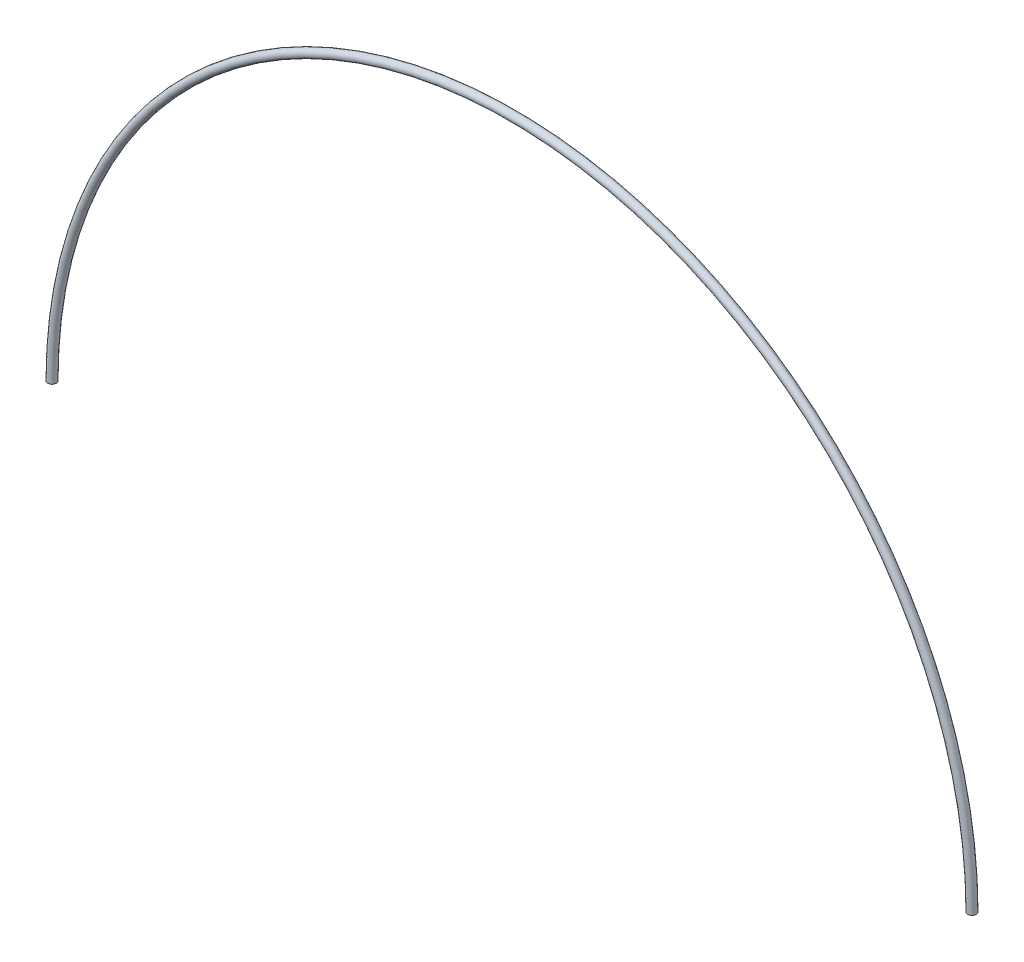
from build123d import *

# Parameters (mm, degrees)
SKETCH11_R   = 14.7701
SKETCH11_R_2 = 13.3223


with BuildPart() as part:
    # Sweep1: sweep along a path in Sketch7
    with BuildLine(Plane.XY) as sweep1_path:
        ThreePointArc((0, 0), (1600.2, 1600.2), (3200.4, 0))
    # Sketch11 → Sweep1 (sweep)
    with BuildSketch(Plane(origin=(0, 0, 0), x_dir=(1, 0, 0), z_dir=(0, 1, 0))):
        Circle(SKETCH11_R)
        Circle(SKETCH11_R_2, mode=Mode.SUBTRACT)
    sweep(path=sweep1_path.line)


solid = part.part
